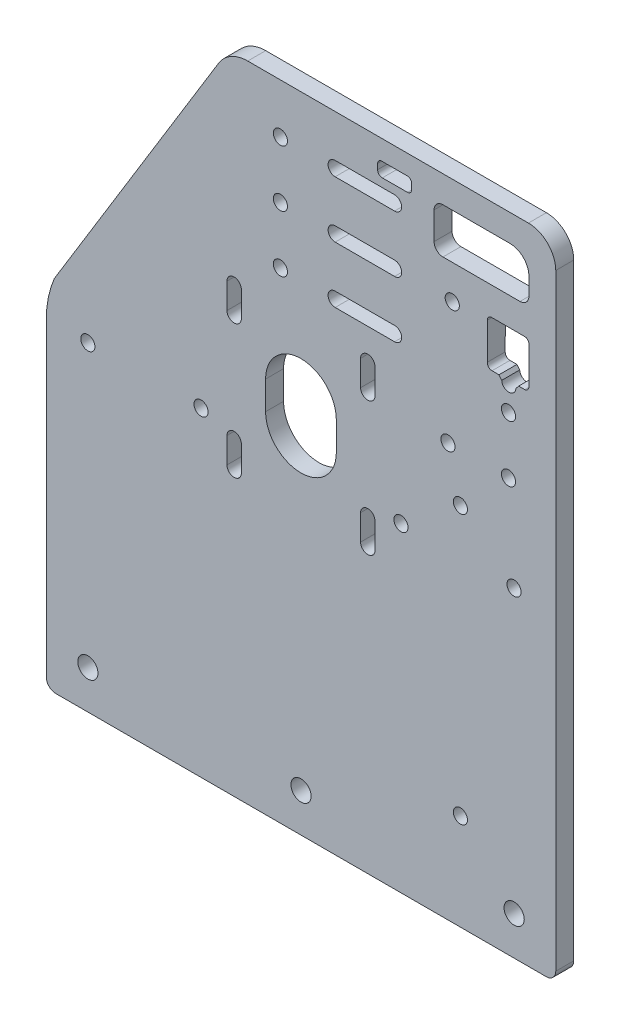
from build123d import *

# Parameters (mm, degrees)
MODEL_R             = 3.5687
MODEL_R_2           = 2.50063
BOSS_EXTRUDE1_DEPTH = 6.35


with BuildPart() as part:
    # Model → Boss-Extrude1 (new body)
    with BuildSketch(Plane.XY):
        with BuildLine():
            Line((-195.531291458, -109.717656077), (-195.531291458, -0.364458494))
            ThreePointArc((-195.531291458, -0.364458494), (-194.811220192, 6.804036519), (-192.679778414, 13.686098661))
            Line((-192.679778414, 13.686098661), (-134.587886802, 108.667860444))
            ThreePointArc((-134.587886802, 108.667860444), (-130.212488604, 112.876263711), (-124.338469082, 114.409450622))
            Line((-124.338469082, 114.409450622), (-25.155306777, 114.409450622))
            ThreePointArc((-25.155306777, 114.409450622), (-18.320721917, 111.578459049), (-15.489778233, 104.743854352))
            Line((-15.489778233, 104.743854352), (-15.491291459, -109.717656077))
            ThreePointArc((-15.491291459, -109.717656077), (-16.476227854, -112.095502881), (-18.854074658, -113.080439277))
            Line((-18.854074658, -113.080439277), (-192.168508258, -113.080439277))
            ThreePointArc((-192.168508258, -113.080439277), (-194.546355062, -112.095502881), (-195.531291458, -109.717656077))
        make_face()
        with Locations((-105.511291458, -99.416633634)):
            Circle(MODEL_R, mode=Mode.SUBTRACT)
        with Locations((-30.191291459, -99.416633634)):
            Circle(MODEL_R, mode=Mode.SUBTRACT)
        with Locations((-180.831291458, -99.416633634)):
            Circle(MODEL_R, mode=Mode.SUBTRACT)
        with Locations((-112.800535337, 96.904216384)):
            Circle(MODEL_R_2, mode=Mode.SUBTRACT)
        with Locations((-112.800535337, 76.904216384)):
            Circle(MODEL_R_2, mode=Mode.SUBTRACT)
        with Locations((-112.800535337, 56.874490518)):
            Circle(MODEL_R_2, mode=Mode.SUBTRACT)
        with Locations((-52.065695289, 76.858190171)):
            Circle(MODEL_R_2, mode=Mode.SUBTRACT)
        with Locations((-53.581703018, 32.899307373)):
            Circle(MODEL_R_2, mode=Mode.SUBTRACT)
        with Locations((-49.191291458, 15.951915647)):
            Circle(MODEL_R_2, mode=Mode.SUBTRACT)
        with Locations((-32.191291412, 52.89930739)):
            Circle(MODEL_R_2, mode=Mode.SUBTRACT)
        with Locations((-32.191291073, 32.899307373)):
            Circle(MODEL_R_2, mode=Mode.SUBTRACT)
        with Locations((-30.23652443, 0.163856763)):
            Circle(MODEL_R_2, mode=Mode.SUBTRACT)
        with Locations((-70.191291459, -0.055133214)):
            Circle(MODEL_R_2, mode=Mode.SUBTRACT)
        with Locations((-140.831291458, -0.055133214)):
            Circle(MODEL_R_2, mode=Mode.SUBTRACT)
        with Locations((-180.831291459, -0.055133212)):
            Circle(MODEL_R_2, mode=Mode.SUBTRACT)
        with Locations((-49.191291458, -79.0480842)):
            Circle(MODEL_R_2, mode=Mode.SUBTRACT)
        with BuildLine():
            Line((-93.44346941, 94.43343728), (-72.443335776, 94.43343728))
            ThreePointArc((-72.443335776, 94.43343728), (-69.943334966, 96.93343809), (-72.443335776, 99.4334389))
            Line((-72.443335776, 99.4334389), (-93.44346941, 99.4334389))
            ThreePointArc((-93.44346941, 99.4334389), (-95.943470221, 96.93343809), (-93.44346941, 94.43343728))
        make_face(mode=Mode.SUBTRACT)
        with BuildLine():
            Line((-79.379374317, -12.874388322), (-79.379374317, -3.874412101))
            ThreePointArc((-79.379374317, -3.874412101), (-81.919367317, -1.334419101), (-84.459360317, -3.874412101))
            Line((-84.459360317, -3.874412101), (-84.459360317, -12.874388322))
            ThreePointArc((-84.459360317, -12.874388322), (-81.919367317, -15.414381322), (-79.379374317, -12.874388322))
        make_face(mode=Mode.SUBTRACT)
        with BuildLine():
            Line((-79.379374317, 34.36948148), (-79.379374317, 43.369457701))
            ThreePointArc((-79.379374317, 43.369457701), (-81.919367317, 45.909450701), (-84.459360317, 43.369457701))
            Line((-84.459360317, 43.369457701), (-84.459360317, 34.36948148))
            ThreePointArc((-84.459360317, 34.36948148), (-81.919367317, 31.82948848), (-79.379374317, 34.36948148))
        make_face(mode=Mode.SUBTRACT)
        with BuildLine():
            Line((-76.774493611, 102.430359236), (-67.894578253, 102.444637455))
            ThreePointArc((-67.894578253, 102.444637455), (-66.878577292, 102.865478833), (-66.457735914, 103.881479794))
            Line((-66.457735914, 103.881479794), (-66.457735914, 105.999769505))
            ThreePointArc((-66.457735914, 105.999769505), (-66.878577292, 107.015770466), (-67.894578253, 107.436611843))
            Line((-67.894578253, 107.436611843), (-76.992337138, 107.436611843))
            ThreePointArc((-76.992337138, 107.436611843), (-78.008338099, 107.015770466), (-78.429179476, 105.999769505))
            Line((-78.429179476, 105.999769505), (-78.443457695, 104.09932332))
            ThreePointArc((-78.443457695, 104.09932332), (-77.955415692, 102.918401239), (-76.774493611, 102.430359236))
        make_face(mode=Mode.SUBTRACT)
        with BuildLine():
            Line((-38.022285247, 62.781522119), (-35.552306408, 62.78308177))
            Line((-35.552306408, 62.78308177), (-34.582327568, 61.569828187))
            ThreePointArc((-34.582327568, 61.569828187), (-32.081364805, 59.175785763), (-29.582327568, 61.571838091))
            Line((-29.582327568, 61.571838091), (-28.612348728, 62.792230783))
            Line((-28.612348728, 62.792230783), (-26.426638777, 62.795800338))
            ThreePointArc((-26.426638777, 62.795800338), (-25.404720412, 63.283848845), (-24.989838628, 64.337595301))
            Line((-24.989838628, 64.337595301), (-24.989838628, 77.586949943))
            ThreePointArc((-24.989838628, 77.586949943), (-25.410680005, 78.602950904), (-26.426680966, 79.023792281))
            Line((-26.426680966, 79.023792281), (-38.022327436, 79.0380705))
            ThreePointArc((-38.022327436, 79.0380705), (-39.195708618, 78.575783886), (-39.685435446, 77.413587713))
            Line((-39.685435446, 77.413587713), (-39.69129152, 64.555438828))
            ThreePointArc((-39.69129152, 64.555438828), (-39.240439702, 63.307518511), (-38.022285247, 62.781522119))
        make_face(mode=Mode.SUBTRACT)
        with BuildLine():
            Line((-55.353814173, 88.936612327), (-28.125863081, 88.936612327))
            ThreePointArc((-28.125863081, 88.936612327), (-25.908358924, 89.855132624), (-24.989838628, 92.072636781))
            Line((-24.989838628, 92.072636781), (-24.989838628, 98.260334755))
            ThreePointArc((-24.989838628, 98.260334755), (-26.937319576, 102.961969673), (-31.638954494, 104.909450622))
            Line((-31.638954494, 104.909450622), (-55.353814173, 104.909450622))
            ThreePointArc((-55.353814173, 104.909450622), (-57.571318331, 103.990930325), (-58.489838627, 101.773426168))
            Line((-58.489838627, 101.773426168), (-58.489838627, 92.072636781))
            ThreePointArc((-58.489838627, 92.072636781), (-57.571318331, 89.855132624), (-55.353814173, 88.936612327))
        make_face(mode=Mode.SUBTRACT)
        with BuildLine():
            Line((-93.44346941, 74.433418373), (-72.443335776, 74.433418373))
            ThreePointArc((-72.443335776, 74.433418373), (-69.943334966, 76.933419183), (-72.443335776, 79.433419993))
            Line((-72.443335776, 79.433419993), (-93.44346941, 79.433419993))
            ThreePointArc((-93.44346941, 79.433419993), (-95.943470221, 76.933419183), (-93.44346941, 74.433418373))
        make_face(mode=Mode.SUBTRACT)
        with BuildLine():
            Line((-93.44346941, 54.43348809), (-72.443335776, 54.43348809))
            ThreePointArc((-72.443335776, 54.43348809), (-69.943347665, 56.9334762), (-72.443335776, 59.433464311))
            Line((-72.443335776, 59.433464311), (-93.44346941, 59.433464311))
            ThreePointArc((-93.44346941, 59.433464311), (-95.943457521, 56.9334762), (-93.44346941, 54.43348809))
        make_face(mode=Mode.SUBTRACT)
        with BuildLine():
            Line((-118.031293904, 10.239724211), (-118.031293904, 20.239724509))
            ThreePointArc((-118.031293904, 20.239724509), (-105.531294274, 32.73972451), (-93.031293902, 20.239725251))
            Line((-93.031293902, 20.239725251), (-93.031293902, 10.239724953))
            ThreePointArc((-93.031293902, 10.239724953), (-105.531293532, -2.260275048), (-118.031293904, 10.239724211))
        make_face(mode=Mode.SUBTRACT)
        with BuildLine():
            Line((-126.603228231, 43.369457701), (-126.603228231, 34.36948148))
            ThreePointArc((-126.603228231, 34.36948148), (-129.143221232, 31.82948848), (-131.683214232, 34.36948148))
            Line((-131.683214232, 34.36948148), (-131.683214232, 43.369457701))
            ThreePointArc((-131.683214232, 43.369457701), (-129.143221232, 45.909450701), (-126.603228231, 43.369457701))
        make_face(mode=Mode.SUBTRACT)
        with BuildLine():
            Line((-131.683214232, -12.874388322), (-131.683214232, -3.874412101))
            ThreePointArc((-131.683214232, -3.874412101), (-129.143221232, -1.334419101), (-126.603228231, -3.874412101))
            Line((-126.603228231, -3.874412101), (-126.603228231, -12.874388322))
            ThreePointArc((-126.603228231, -12.874388322), (-129.143221232, -15.414381322), (-131.683214232, -12.874388322))
        make_face(mode=Mode.SUBTRACT)
    extrude(amount=BOSS_EXTRUDE1_DEPTH)


solid = part.part
